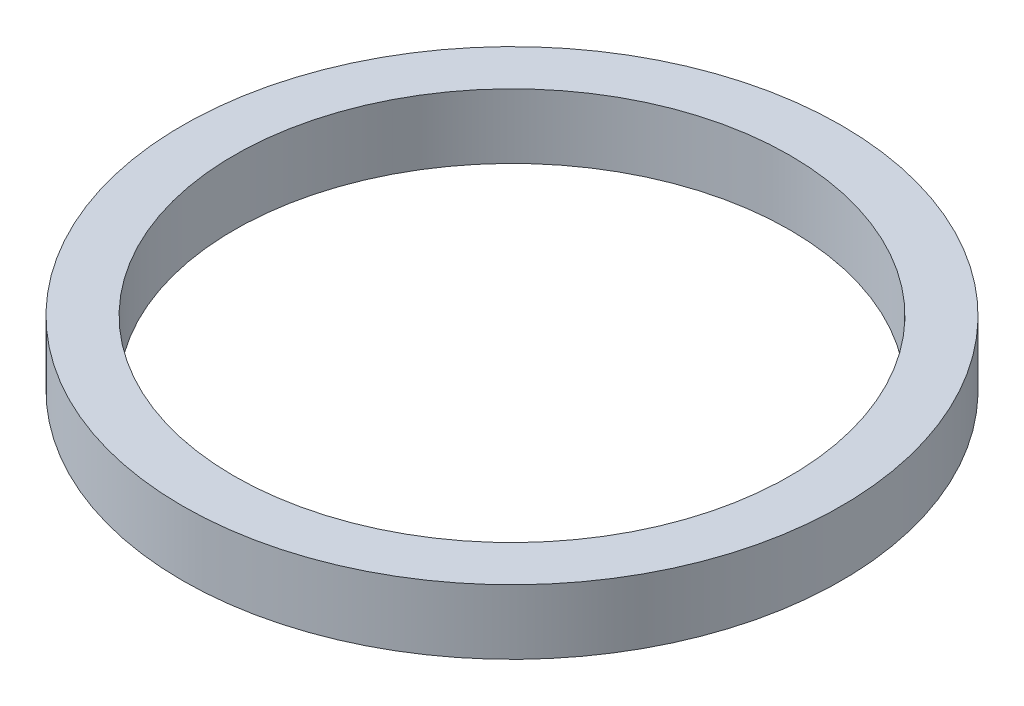
from build123d import *

# Parameters (mm, degrees)
CROQUIS1_R              = 25.5
CROQUIS1_R_2            = 21.5
SALIENTE_EXTRUIR1_DEPTH = 5


with BuildPart() as part:
    # Croquis1 → Saliente-Extruir1 (new body)
    with BuildSketch(Plane(origin=(0, 0, 0), x_dir=(1, 0, 0), z_dir=(0, 1, 0))):
        with Locations(Location((0, 0, 0), (0, 0, 270))):
            Circle(CROQUIS1_R)
        with Locations(Location((0, 0, 0), (0, 0, 270))):
            Circle(CROQUIS1_R_2, mode=Mode.SUBTRACT)
    extrude(amount=SALIENTE_EXTRUIR1_DEPTH)


solid = part.part
